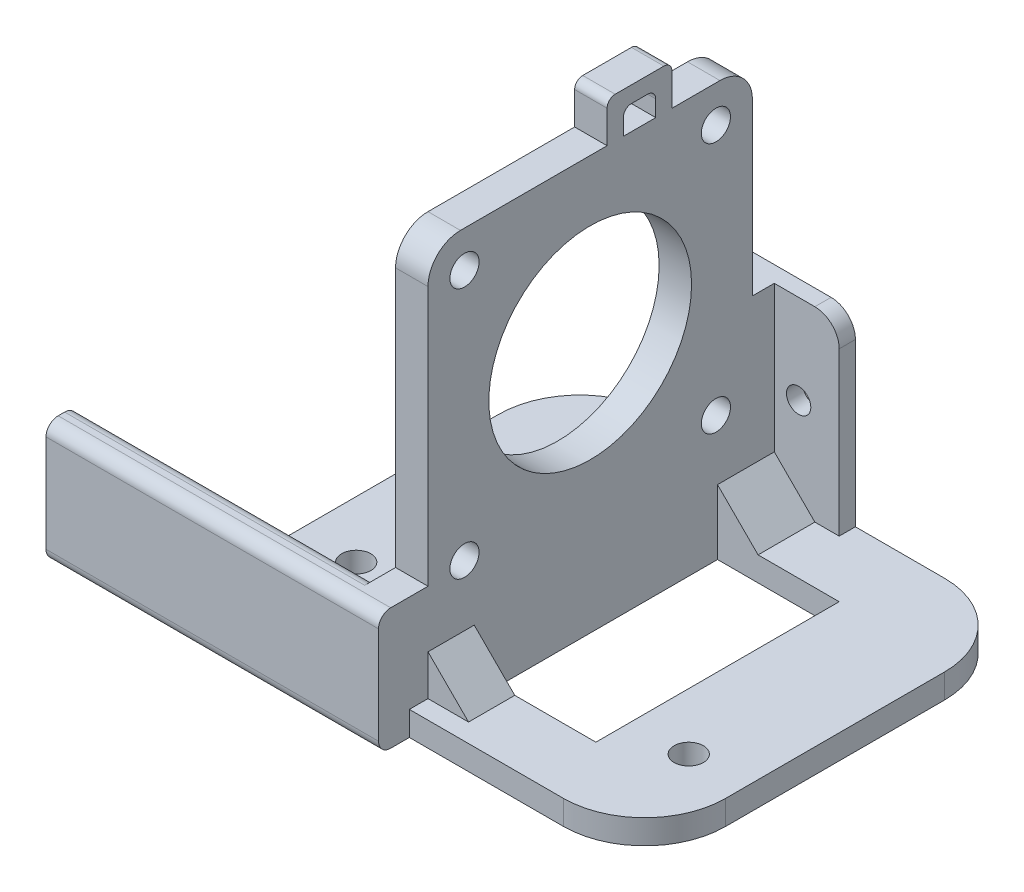
from build123d import *

# Parameters (mm, degrees)
SKETCH_1_W           = 55
SKETCH_1_H           = 47
EXTRUDE_1_DEPTH      = 3
SKETCH_2_W           = 4
SKETCH_2_H           = 40
EXTRUDE_2_DEPTH      = 48
SKETCH_3_R           = 1.8
CUT_EXTRUDE_1_DEPTH  = 12
SKETCH_4_R           = 1.8
SKETCH_4_R_2         = 12.5
CUT_EXTRUDE_2_DEPTH  = 12
SKETCH_5_W           = 15
SKETCH_5_H           = 30
CUT_EXTRUDE_3_DEPTH  = 12
FILLET_1_R           = 10
FILLET_2_R           = 4
CHAMFER_1_SIZE       = 5
EXTRUDE_START        = -12
EXTRUDE_3_DEPTH      = 16
EXTRUDE_4_DEPTH      = 26
EXTRUDE_4_DEPTH_BACK = 15
SKETCH_7_W           = 3.8
SKETCH_7_H           = 15
FILLET_3_R           = 1.5
SKETCH_8_W           = 4
SKETCH_8_H           = 12
EXTRUDE_5_DEPTH      = 3.8
SKETCH_9_W           = 20
SKETCH_9_H           = 2
EXTRUDE_6_DEPTH      = 23
EXTRUDE_7_DEPTH      = 2.7
SKETCH_11_R          = 1.5
CUT_EXTRUDE_4_DEPTH  = 23
FILLET_4_R           = 3
EXTRUDE_START_2      = -4
SKETCH_12_W          = 2
SKETCH_12_H          = 3
EXTRUDE_8_DEPTH      = 4
FILLET_5_R           = 1


with BuildPart() as part:
    # Эскиз1 → Бобышка-Вытянуть1 (new body)
    with BuildSketch(Plane(origin=(0, 0, 0), x_dir=(1, 0, 0), z_dir=(0, 1, 0))):
        with Locations((27.5, 23.5)):
            Rectangle(SKETCH_1_W, SKETCH_1_H)
    extrude(amount=EXTRUDE_1_DEPTH)

    # Эскиз2 → Бобышка-Вытянуть2 (add)
    with BuildSketch(Plane(origin=(-5.991084473, 3, 0), x_dir=(1, 0, 0), z_dir=(0, 1, 0))):
        with Locations((29.991084473, 22.3)):
            Rectangle(SKETCH_2_W, SKETCH_2_H)
    extrude(amount=EXTRUDE_2_DEPTH)

    # Эскиз3 → Вырез-Вытянуть1 (cut)
    with BuildSketch(Plane(origin=(0, 3, 0), x_dir=(1, 0, 0), z_dir=(0, 1, 0))):
        with Locations(Location((7, 12.45, 0), (0, 0, 270))):
            Circle(SKETCH_3_R)
        with Locations(Location((48, 12.45, 0), (0, 0, 270))):
            Circle(SKETCH_3_R)
    extrude(amount=-CUT_EXTRUDE_1_DEPTH, mode=Mode.SUBTRACT)

    # Эскиз4 → Вырез-Вытянуть2 (cut)
    with BuildSketch(Plane(origin=(26, 0, 0), x_dir=(0, 0, -1), z_dir=(1, 0, 0))):
        with Locations((6.8, 46.5)):
            Circle(SKETCH_4_R)
        with Locations((37.8, 46.5)):
            Circle(SKETCH_4_R)
        with Locations((6.8, 15.5)):
            Circle(SKETCH_4_R)
        with Locations((37.8, 15.5)):
            Circle(SKETCH_4_R)
        with Locations((22.3, 31)):
            Circle(SKETCH_4_R_2)
    extrude(amount=-CUT_EXTRUDE_2_DEPTH, mode=Mode.SUBTRACT)

    # Эскиз5 → Вырез-Вытянуть3 (cut)
    with BuildSketch(Plane(origin=(0, 3, 0), x_dir=(1, 0, 0), z_dir=(0, 1, 0))):
        with Locations((33.5, 23)):
            Rectangle(SKETCH_5_W, SKETCH_5_H)
    extrude(amount=-CUT_EXTRUDE_3_DEPTH, mode=Mode.SUBTRACT)

    # Скругление1
    fillet_1_edges = [part.edges().sort_by_distance(p)[0] for p in [
        (0, 1.5, -47),
        (55, 1.5, -47),
        (55, 1.5, 0),
    ]]
    fillet(fillet_1_edges, radius=FILLET_1_R)

    # Скругление2
    fillet_2_edges = [part.edges().sort_by_distance(p)[0] for p in [
        (24, 51, -2.3),
        (24, 51, -42.3),
    ]]
    fillet(fillet_2_edges, radius=FILLET_2_R)

    # Фаска1
    chamfer_1_edges = [part.edges().sort_by_distance(p)[0] for p in [
        (26, 3, -5.15),
        (26, 3, -40.15),
    ]]
    chamfer(chamfer_1_edges, length=CHAMFER_1_SIZE)

    # Эскиз6 → Бобышка-Вытянуть3 (add)
    with BuildSketch(Plane(origin=(0, 0, -42.3), x_dir=(-1, 0, 0), z_dir=(0, 0, -1)).offset(EXTRUDE_START)):
        Polygon((-22, 3), (-22, 7), (-17, 3), align=None)
    extrude(amount=-EXTRUDE_3_DEPTH)

    # Эскиз7 → Бобышка-Вытянуть4 (add, two sides: drawn at the far end of the back side and taken through both)
    with BuildSketch(Plane(origin=(0, 0, 0), x_dir=(0, 0, -1), z_dir=(1, 0, 0)).offset(-EXTRUDE_4_DEPTH_BACK)):
        with Locations((-1.9, 7.5)):
            Rectangle(SKETCH_7_W, SKETCH_7_H)
    extrude(amount=EXTRUDE_4_DEPTH + EXTRUDE_4_DEPTH_BACK)

    # Скругление3
    fillet_3_edges = [part.edges().sort_by_distance(p)[0] for p in [
        (5.5, 15, 0),
        (5.5, 0, 3.8),
        (5.5, 15, 3.8),
        (-7.5, 0, 0),
        (13, 3, 0),
    ]]
    fillet(fillet_3_edges, radius=FILLET_3_R)

    # Эскиз8 → Бобышка-Вытянуть5 (add)
    with BuildSketch(Plane.XY.offset(-2.3)):
        with Locations((24, 9)):
            Rectangle(SKETCH_8_W, SKETCH_8_H)
    extrude(amount=EXTRUDE_5_DEPTH)

    # Эскиз9 → Бобышка-Вытянуть6 (add)
    with BuildSketch(Plane(origin=(0, 3, 0), x_dir=(1, 0, 0), z_dir=(0, 1, 0))):
        with Locations((24, 46)):
            Rectangle(SKETCH_9_W, SKETCH_9_H)
    extrude(amount=EXTRUDE_6_DEPTH)

    # Эскиз10 → Бобышка-Вытянуть7 (add)
    with BuildSketch(Plane(origin=(0, 0, -42.3), x_dir=(-1, 0, 0), z_dir=(0, 0, -1))):
        Polygon((-22, 26), (-26, 26), (-26, 8), (-31, 3), (-22, 3), align=None)
    extrude(amount=EXTRUDE_7_DEPTH)

    # Эскиз11 → Вырез-Вытянуть4 (cut)
    with BuildSketch(Plane(origin=(0, 0, -47), x_dir=(-1, 0, 0), z_dir=(0, 0, -1))):
        with Locations((-29, 15)):
            Circle(SKETCH_11_R)
        with Locations((-19, 15)):
            Circle(SKETCH_11_R)
    extrude(amount=-CUT_EXTRUDE_4_DEPTH, mode=Mode.SUBTRACT)

    # Скругление4
    fillet_4_edges = [part.edges().sort_by_distance(p)[0] for p in [
        (14, 26, -46),
        (34, 26, -46),
    ]]
    fillet(fillet_4_edges, radius=FILLET_4_R)

    # Эскиз12 → Бобышка-Вытянуть8 (add)
    with BuildSketch(Plane.ZY.offset(-22).offset(EXTRUDE_START_2)):
        Polygon((-32.382601146, 56), (-32.382601146, 54), (-30.382601146, 54), (-26.382601146, 54), (-24.382601146, 54), (-24.382601146, 56), align=None)
        with Locations((-31.382601146, 52.5)):
            Rectangle(SKETCH_12_W, SKETCH_12_H)
        with Locations((-25.382601146, 52.5)):
            Rectangle(SKETCH_12_W, SKETCH_12_H)
    extrude(amount=EXTRUDE_8_DEPTH)

    # Скругление5
    fillet_5_edges = [part.edges().sort_by_distance(p)[0] for p in [
        (24, 54, -26.382601146),
        (24, 54, -30.382601146),
        (24, 56, -32.382601146),
        (24, 56, -24.382601146),
    ]]
    fillet(fillet_5_edges, radius=FILLET_5_R)


solid = part.part
